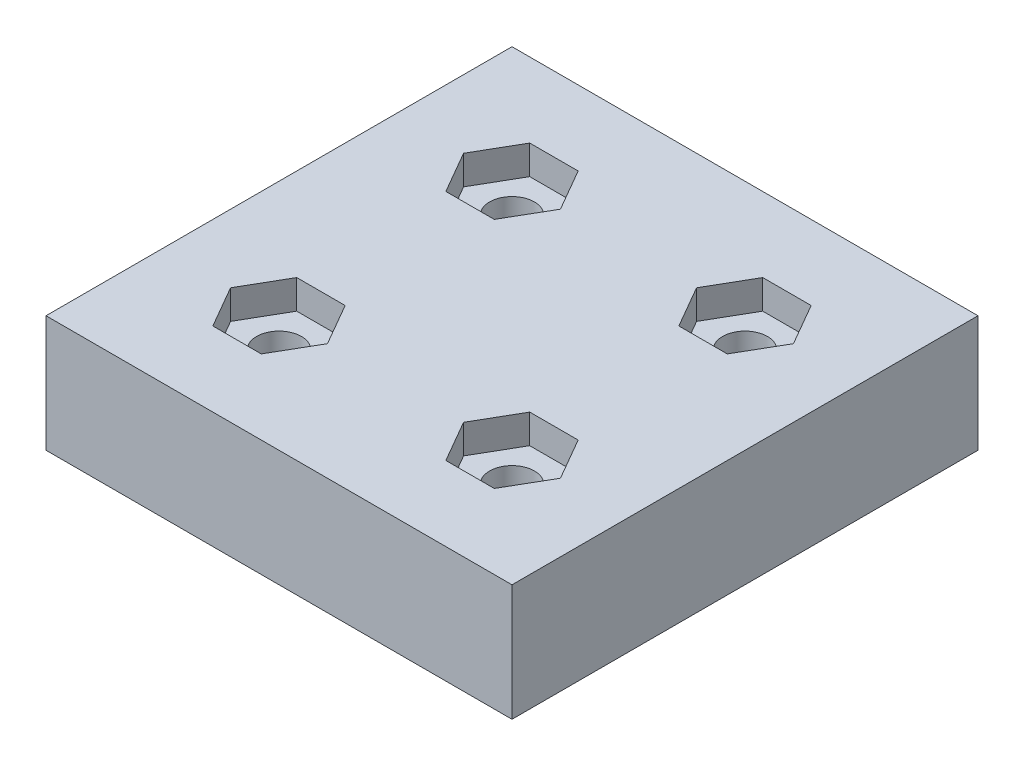
from build123d import *

# Parameters (mm, degrees)
SKETCH1_W           = 40
SKETCH1_H           = 40
SKETCH1_R           = 1.925
BOSS_EXTRUDE1_DEPTH = 10
CUT_EXTRUDE1_DEPTH  = 2.5


with BuildPart() as part:
    # Sketch1 → Boss-Extrude1 (new body)
    with BuildSketch(Plane(origin=(0, 0, 0), x_dir=(1, 0, 0), z_dir=(0, 1, 0))):
        with Locations((20, 20)):
            Rectangle(SKETCH1_W, SKETCH1_H)
        with Locations(Location((10, 30, 0), (0, 0, 270))):
            Circle(SKETCH1_R, mode=Mode.SUBTRACT)
        with Locations(Location((30, 30, 0), (0, 0, 270))):
            Circle(SKETCH1_R, mode=Mode.SUBTRACT)
        with Locations(Location((30, 10, 0), (0, 0, 270))):
            Circle(SKETCH1_R, mode=Mode.SUBTRACT)
        with Locations(Location((10, 10, 0), (0, 0, 270))):
            Circle(SKETCH1_R, mode=Mode.SUBTRACT)
    extrude(amount=BOSS_EXTRUDE1_DEPTH)

    # Sketch2 → Cut-Extrude1 (cut)
    with BuildSketch(Plane(origin=(0, 10, 0), x_dir=(1, 0, 0), z_dir=(0, 1, 0))):
        Polygon((14.156921938, 10), (12.078460969, 13.6), (7.921539031, 13.6), (5.843078062, 10), (7.921539031, 6.4), (12.078460969, 6.4), align=None)
        Polygon((25.843078062, 10), (27.921539031, 6.4), (32.078460969, 6.4), (34.156921938, 10), (32.078460969, 13.6), (27.921539031, 13.6), align=None)
        Polygon((25.843078062, 30), (27.921539031, 26.4), (32.078460969, 26.4), (34.156921938, 30), (32.078460969, 33.6), (27.921539031, 33.6), align=None)
        Polygon((14.156921938, 30), (12.078460969, 33.6), (7.921539031, 33.6), (5.843078062, 30), (7.921539031, 26.4), (12.078460969, 26.4), align=None)
    extrude(amount=-CUT_EXTRUDE1_DEPTH, mode=Mode.SUBTRACT)


solid = part.part
